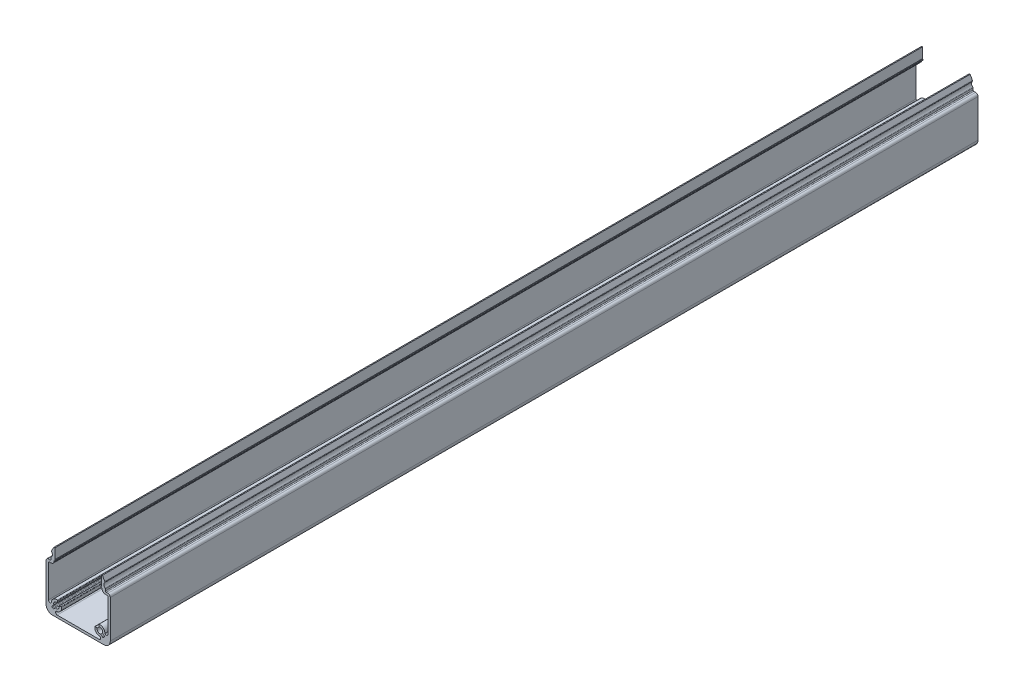
from build123d import *

# Parameters (mm, degrees)
BOSS_EXTRUDE1_DEPTH = 540


with BuildPart() as part:
    # Sketch1 → Boss-Extrude1 (new body)
    with BuildSketch(Plane.XY.offset(20)):
        with BuildLine():
            Line((4, 0), (36, 0))
            ThreePointArc((36, 0), (38.828427125, 1.171572875), (40, 4))
            Line((40, 4), (40, 27.499999994))
            ThreePointArc((40, 27.499999994), (39.56066017, 28.56066017), (38.499999994, 29))
            Line((38.499999994, 29), (37.408493132, 29))
            ThreePointArc((37.408493132, 29), (37.05493974, 29.14644661), (36.90849313, 29.500000002))
            Line((36.90849313, 29.500000002), (36.90849313, 30.572020267))
            ThreePointArc((36.90849313, 30.572020267), (36.86079319, 30.785150869), (36.726794508, 30.957616203))
            ThreePointArc((36.726794508, 30.957616203), (36.005111578, 32.357100716), (36.519951827, 33.845160752))
            ThreePointArc((36.519951827, 33.845160752), (36.647077826, 34.128030253), (36.582952488, 34.431450944))
            Line((36.582952488, 34.431450944), (35.099999998, 37.000000001))
            Line((35.099999998, 37.000000001), (34.500000002, 37.000000001))
            Line((34.500000002, 37.000000001), (34.500000002, 30.672689193))
            Line((34.500000002, 30.672689193), (34.158493132, 30.561067543))
            Line((34.158493132, 30.561067543), (34.158493132, 29.989862813))
            Line((34.158493132, 29.989862813), (34.908493132, 29.989862813))
            Line((34.908493132, 29.989862813), (34.908493132, 29.700000011))
            ThreePointArc((34.908493132, 29.700000011), (35.494279572, 28.285786443), (36.908493141, 27.700000003))
            Line((36.908493141, 27.700000003), (38.000000017, 27.700000003))
            ThreePointArc((38.000000017, 27.700000003), (38.353553409, 27.553553393), (38.500000019, 27.200000001))
            Line((38.500000019, 27.200000001), (38.500000019, 6.9547727))
            ThreePointArc((38.500000019, 6.9547727), (37.882683451, 6.030893167), (36.792893237, 6.247665919))
            Line((36.792893237, 6.247665919), (36.648161659, 6.392397496))
            ThreePointArc((36.648161659, 6.392397496), (35.587251229, 8.859212237), (33.009530056, 9.611581471))
            ThreePointArc((33.009530056, 9.611581471), (32.804700675, 9.478725012), (32.766463725, 9.237594653))
            Line((32.766463725, 9.237594653), (33.047066675, 8.190370192))
            ThreePointArc((33.047066675, 8.190370192), (34.786339421, 7.686520507), (35.148364083, 5.912296075))
            Line((35.148364083, 5.912296075), (36.146446608, 4.91421355))
            ThreePointArc((36.146446608, 4.91421355), (36.292893217, 4.560660161), (36.146446608, 4.207106773))
            Line((36.146446608, 4.207106773), (35.792893214, 3.853553379))
            ThreePointArc((35.792893214, 3.853553379), (35.439339826, 3.70710677), (35.085786437, 3.853553379))
            Line((35.085786437, 3.853553379), (34.087703906, 4.85163591))
            ThreePointArc((34.087703906, 4.85163591), (32.313479487, 5.213660585), (31.809629807, 6.952933321))
            Line((31.809629807, 6.952933321), (30.762405333, 7.233536272))
            ThreePointArc((30.762405333, 7.233536272), (30.521274984, 7.195299323), (30.38841853, 6.990469949))
            ThreePointArc((30.38841853, 6.990469949), (31.140787752, 4.412748784), (33.607602477, 3.351838341))
            Line((33.607602477, 3.351838341), (33.752334032, 3.207106785))
            ThreePointArc((33.752334032, 3.207106785), (33.969106782, 2.117316579), (33.045227255, 1.500000015))
            Line((33.045227255, 1.500000015), (6.954772716, 1.500000015))
            ThreePointArc((6.954772716, 1.500000015), (6.030893183, 2.117316583), (6.247665934, 3.207106797))
            Line((6.247665934, 3.207106797), (6.392397512, 3.351838375))
            ThreePointArc((6.392397512, 3.351838375), (8.859212224, 4.412748803), (9.611581449, 6.990469949))
            ThreePointArc((9.611581449, 6.990469949), (9.478724996, 7.195299323), (9.237594646, 7.233536272))
            Line((9.237594646, 7.233536272), (8.190370187, 6.952933328))
            ThreePointArc((8.190370187, 6.952933328), (7.686520502, 5.213660596), (5.912296085, 4.851635932))
            Line((5.912296085, 4.851635932), (4.914213553, 3.8535534))
            ThreePointArc((4.914213553, 3.8535534), (4.560660164, 3.707106791), (4.207106776, 3.8535534))
            Line((4.207106776, 3.8535534), (3.853553388, 4.207106787))
            ThreePointArc((3.853553388, 4.207106787), (3.70710678, 4.560660175), (3.853553388, 4.914213564))
            Line((3.853553388, 4.914213564), (4.85163592, 5.912296095))
            ThreePointArc((4.85163592, 5.912296095), (5.213660585, 7.686520517), (6.952933322, 8.190370198))
            Line((6.952933322, 8.190370198), (7.233536268, 9.237594644))
            ThreePointArc((7.233536268, 9.237594644), (7.195299318, 9.478725003), (6.990469936, 9.611581462))
            ThreePointArc((6.990469936, 9.611581462), (4.412748785, 8.859212233), (3.351838362, 6.392397513))
            Line((3.351838362, 6.392397513), (3.207106785, 6.247665935))
            ThreePointArc((3.207106785, 6.247665935), (2.11731657, 6.030893183), (1.500000002, 6.954772717))
            Line((1.500000002, 6.954772717), (1.500000002, 27.200000001))
            ThreePointArc((1.500000002, 27.200000001), (1.646446612, 27.553553393), (2.000000004, 27.700000003))
            Line((2.000000004, 27.700000003), (3.091506864, 27.700000003))
            ThreePointArc((3.091506864, 27.700000003), (4.505720432, 28.285786443), (5.091506872, 29.700000011))
            Line((5.091506872, 29.700000011), (5.091506872, 29.989862813))
            Line((5.091506872, 29.989862813), (5.841506868, 29.989862813))
            Line((5.841506868, 29.989862813), (5.841506868, 30.561067541))
            Line((5.841506868, 30.561067541), (5.499999998, 30.672689191))
            Line((5.499999998, 30.672689191), (5.499999998, 37.000000001))
            Line((5.499999998, 37.000000001), (4.899999998, 37.000000001))
            Line((4.899999998, 37.000000001), (3.417047508, 34.431450944))
            ThreePointArc((3.417047508, 34.431450944), (3.35292217, 34.128030253), (3.480048169, 33.845160751))
            ThreePointArc((3.480048169, 33.845160751), (3.99488842, 32.357100716), (3.273205491, 30.957616203))
            ThreePointArc((3.273205491, 30.957616203), (3.13920681, 30.785150869), (3.09150687, 30.572020267))
            Line((3.09150687, 30.572020267), (3.09150687, 29.500000002))
            ThreePointArc((3.09150687, 29.500000002), (2.94506026, 29.14644661), (2.591506868, 29))
            Line((2.591506868, 29), (1.500000006, 29))
            ThreePointArc((1.500000006, 29), (0.43933983, 28.56066017), (0, 27.499999994))
            Line((0, 27.499999994), (0, 4))
            ThreePointArc((0, 4), (1.171572875, 1.171572875), (4, 0))
        make_face()
    extrude(amount=-BOSS_EXTRUDE1_DEPTH)


solid = part.part
